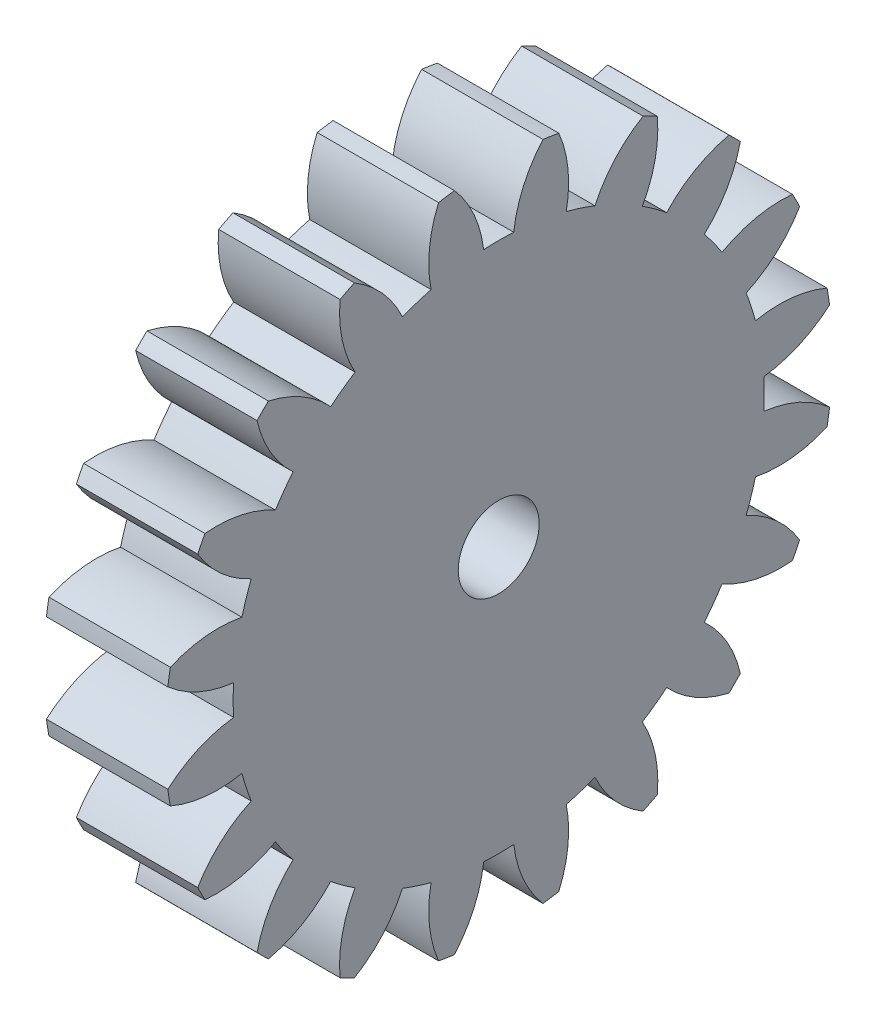
from build123d import *

# Parameters (mm, degrees)
BASPROSKE_W     = 6
BASPROSKE_H     = 16.5
TOOTHCUT_DEPTH  = 25.093567606
TEETHCUTS_COUNT = 20
TEETHCUTS_ANGLE = 342
BORSKE_R        = 2
BORE_DEPTH      = 50.0000508


with BuildPart() as part:
    # BasProSke → Base-Revolve (revolve)
    with BuildSketch(Plane(origin=(0, 0, 0), x_dir=(1, 0, 0), z_dir=(0, 1, 0)), mode=Mode.PRIVATE) as base_revolve_sk:
        with Locations((3, 8.25)):
            Rectangle(BASPROSKE_W, BASPROSKE_H)
    revolve(base_revolve_sk.sketch.rotate(Axis((-10, 0, 0), (1, 0, 0)), 180), axis=Axis((-10, 0, 0), (1, 0, 0)))

    # TooCutSke → ToothCut (cut, through all)
    with BuildSketch(Plane(origin=(0, 0, 0), x_dir=(0, 0, -1), z_dir=(1, 0, 0))):
        with BuildLine():
            ThreePointArc((0.74381438, 13.102904875), (0, 13.124), (-0.74381438, 13.102904875))
            ThreePointArc((-0.74381438, 13.102904875), (-1.226473103, 14.852072512), (-2.209965745, 16.376962373))
            ThreePointArc((-2.209965745, 16.376962373), (0, 16.5254), (2.209965745, 16.376962373))
            ThreePointArc((2.209965745, 16.376962373), (1.226473103, 14.852072512), (0.74381438, 13.102904875))
        make_face()
    toothcut = extrude(amount=TOOTHCUT_DEPTH, mode=Mode.SUBTRACT)

    # TeethCuts: ToothCut ×20 about axis
    teethcuts_axis = Axis((-10, 0, 0), (1, 0, 0))
    for i in range(1, TEETHCUTS_COUNT):
        add(toothcut.rotate(teethcuts_axis, i * TEETHCUTS_ANGLE / (TEETHCUTS_COUNT - 1)), mode=Mode.SUBTRACT)

    # BorSke → Bore (cut, symmetric)
    with BuildSketch(Plane(origin=(0, 0, 0), x_dir=(0, 0, -1), z_dir=(1, 0, 0))):
        with Locations(Location((0, 0, 0), (0, 0, 180))):
            Circle(BORSKE_R)
    extrude(amount=BORE_DEPTH, both=True, mode=Mode.SUBTRACT)


solid = part.part
